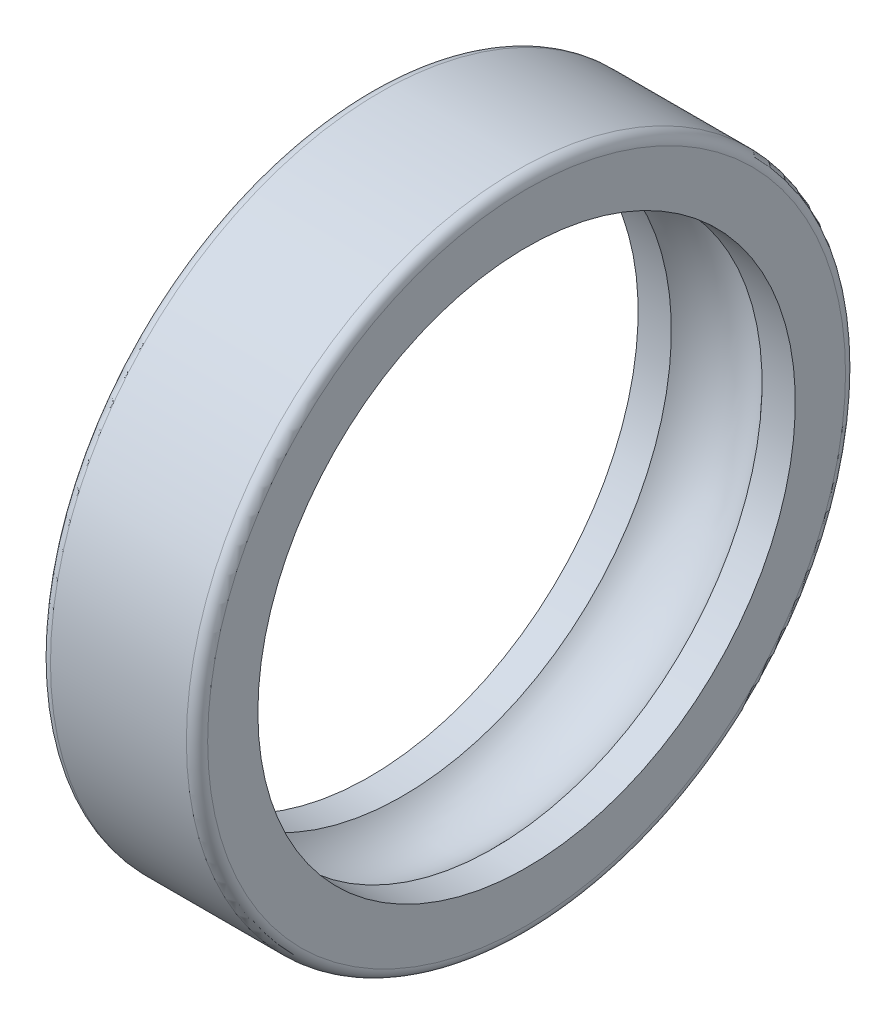
from build123d import *

# Parameters (mm, degrees)
FILLET1_R    = 2.1
SCALE1_SCALE = 0.35


with BuildPart() as part:
    # Sketch1 → Revolve1 (revolve)
    with BuildSketch(Plane.XY, mode=Mode.PRIVATE) as revolve1_sk:
        with BuildLine():
            Line((-15.5, 65), (15.5, 65))
            Line((15.5, 65), (15.5, 53))
            Line((15.5, 53), (8.94427191, 53))
            ThreePointArc((8.94427191, 53), (0, 57), (-8.94427191, 53))
            Line((-8.94427191, 53), (-15.5, 53))
            Line((-15.5, 53), (-15.5, 65))
        make_face()
    revolve(revolve1_sk.sketch.rotate(Axis((-25.358454362, 0, 0), (1, 0, 0)), 90), axis=Axis((-25.358454362, 0, 0), (1, 0, 0)))

    # Fillet1
    fillet1_edges = [part.edges().sort_by_distance(p)[0] for p in [
        (15.5, 0, -65),
        (-15.5, 0, -65),
    ]]
    fillet(fillet1_edges, radius=FILLET1_R)


with BuildPart() as part_1:
    # Scale1: scaled about (0, 0, 0)
    add(part.part.scale(SCALE1_SCALE))


solid = part_1.part
